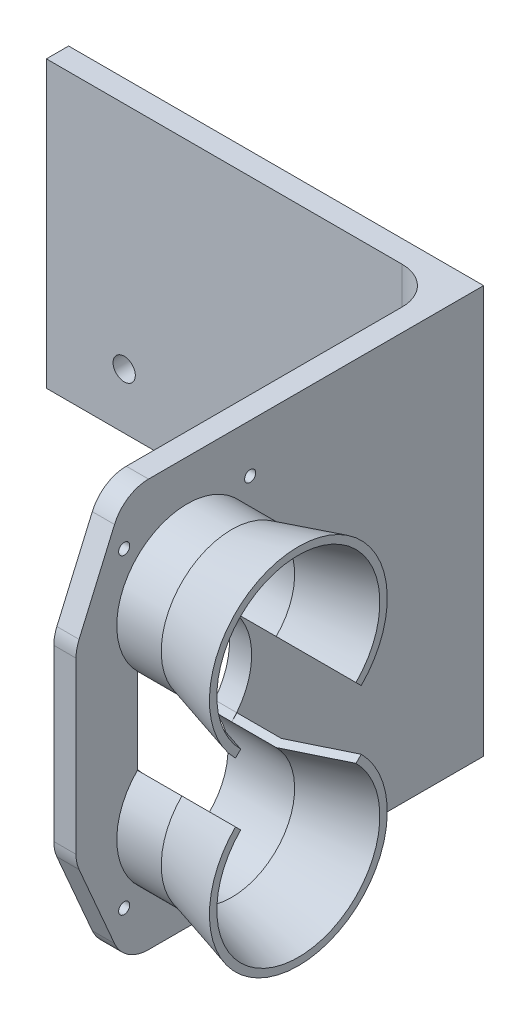
from build123d import *

# Parameters (mm, degrees)
EXTRUDE_1_DEPTH       = 27.5
SKETCH_3_R            = 0.75
CUT_EXTRUDE_3_DEPTH   = 3
REVOLVE_1_ANGLE       = 135
MIRROR_3_COPY_1_ANGLE = 135
MIRROR_3_COPY_2_ANGLE = 135
SKETCH_2_R            = 1.5
SKETCH_2_W            = 20
SKETCH_2_H            = 16.5
CUT_EXTRUDE_4_DEPTH   = 3
FILLET_1_R            = 5
FILLET_2_R            = 5


with BuildPart() as part:
    # 草图1 → 凸台-拉伸1 (new, symmetric)
    with BuildSketch(Plane(origin=(0, 0, 0), x_dir=(1, 0, 0), z_dir=(0, 1, 0))):
        Polygon((-30.117647059, 27.284313725), (25.882352941, 27.284313725), (25.882352941, -27.715686275), (22.882352941, -27.715686275), (22.882352941, 24.284313725), (-30.117647059, 24.284313725), align=None)
    extrude(amount=EXTRUDE_1_DEPTH, both=True)

    # 草图3 → 切除-拉伸3 (cut)
    with BuildSketch(Plane(origin=(25.882352941, 0, 0), x_dir=(0, 0, -1), z_dir=(1, 0, 0))):
        with BuildLine():
            Line((-12.715686275, 12.5), (-6.705278634, 6.48959236))
            ThreePointArc((-6.705278634, 6.48959236), (-4.862710248, 9.247190825), (-4.215686275, 12.5))
            ThreePointArc((-4.215686275, 12.5), (-6.705278634, 18.51040764), (-12.715686275, 21))
            Line((-12.715686275, 21), (-12.715686275, 12.5))
        make_face()
        with BuildLine():
            ThreePointArc((-12.715686275, 4), (-9.462877099, 4.647023974), (-6.705278634, 6.48959236))
            Line((-6.705278634, 6.48959236), (-12.715686275, 12.5))
            Line((-12.715686275, 12.5), (-12.715686275, 4))
        make_face()
        with BuildLine():
            Line((-12.715686275, 12.5), (-18.726093915, 6.48959236))
            ThreePointArc((-18.726093915, 6.48959236), (-15.96849545, 4.647023974), (-12.715686275, 4))
            Line((-12.715686275, 4), (-12.715686275, 12.5))
        make_face()
        with BuildLine():
            ThreePointArc((-12.715686275, 21), (-20.568662301, 15.752809175), (-18.726093915, 6.48959236))
            Line((-18.726093915, 6.48959236), (-12.715686275, 12.5))
            Line((-12.715686275, 12.5), (-12.715686275, 21))
        make_face()
        with BuildLine():
            Line((-12.715686275, 3), (-12.715686275, 0))
            Line((-12.715686275, 0), (-4.017201465, 0))
            ThreePointArc((-4.017201465, 0), (-4.536839235, 3.044356098), (-6.036908978, 5.743970558))
            ThreePointArc((-6.036908978, 5.743970558), (-9.105442495, 3.712728532), (-12.715686275, 3))
        make_face()
        with BuildLine():
            Line((-4.017201465, 0), (-12.715686275, 0))
            Line((-12.715686275, 0), (-12.715686275, -3))
            ThreePointArc((-12.715686275, -3), (-9.105442495, -3.712728532), (-6.036908978, -5.743970558))
            ThreePointArc((-6.036908978, -5.743970558), (-4.536839235, -3.044356098), (-4.017201465, 0))
        make_face()
        with BuildLine():
            Line((-19.394463571, 5.743970558), (-19.394463571, 0))
            Line((-19.394463571, 0), (-12.715686275, 0))
            Line((-12.715686275, 0), (-12.715686275, 3))
            ThreePointArc((-12.715686275, 3), (-16.325930054, 3.712728532), (-19.394463571, 5.743970558))
        make_face()
        with BuildLine():
            Line((-12.715686275, 0), (-19.394463571, 0))
            Line((-19.394463571, 0), (-19.394463571, -5.743970558))
            ThreePointArc((-19.394463571, -5.743970558), (-16.325930054, -3.712728532), (-12.715686275, -3))
            Line((-12.715686275, -3), (-12.715686275, 0))
        make_face()
        with BuildLine():
            Line((-6.705278634, -6.48959236), (-12.715686275, -12.5))
            Line((-12.715686275, -12.5), (-12.715686275, -21))
            ThreePointArc((-12.715686275, -21), (-6.705278634, -18.51040764), (-4.215686275, -12.5))
            ThreePointArc((-4.215686275, -12.5), (-4.862710248, -9.247190825), (-6.705278634, -6.48959236))
        make_face()
        with BuildLine():
            Line((-12.715686275, -4), (-12.715686275, -12.5))
            Line((-12.715686275, -12.5), (-6.705278634, -6.48959236))
            ThreePointArc((-6.705278634, -6.48959236), (-9.462877099, -4.647023974), (-12.715686275, -4))
        make_face()
        with BuildLine():
            ThreePointArc((-12.715686275, -4), (-15.96849545, -4.647023974), (-18.726093915, -6.48959236))
            Line((-18.726093915, -6.48959236), (-12.715686275, -12.5))
            Line((-12.715686275, -12.5), (-12.715686275, -4))
        make_face()
        with BuildLine():
            Line((-12.715686275, -12.5), (-18.726093915, -6.48959236))
            ThreePointArc((-18.726093915, -6.48959236), (-20.568662301, -15.752809175), (-12.715686275, -21))
            Line((-12.715686275, -21), (-12.715686275, -12.5))
        make_face()
        with Locations((-21.215686275, -21)):
            Circle(SKETCH_3_R)
        with Locations((-4.215686275, -21)):
            Circle(SKETCH_3_R)
        with Locations((-21.215686275, 21)):
            Circle(SKETCH_3_R)
        with Locations((-4.215686275, 21)):
            Circle(SKETCH_3_R)
        with BuildLine():
            ThreePointArc((-12.715686275, -3), (-16.325930054, -3.712728532), (-19.394463571, -5.743970558))
            Line((-19.394463571, -5.743970558), (-18.726093915, -6.48959236))
            ThreePointArc((-18.726093915, -6.48959236), (-15.96849545, -4.647023974), (-12.715686275, -4))
            ThreePointArc((-12.715686275, -4), (-9.462877099, -4.647023974), (-6.705278634, -6.48959236))
            Line((-6.705278634, -6.48959236), (-6.036908978, -5.743970558))
            ThreePointArc((-6.036908978, -5.743970558), (-9.105442495, -3.712728532), (-12.715686275, -3))
        make_face()
        with BuildLine():
            Line((-18.726093915, 6.48959236), (-19.394463571, 5.743970558))
            ThreePointArc((-19.394463571, 5.743970558), (-16.325930054, 3.712728532), (-12.715686275, 3))
            ThreePointArc((-12.715686275, 3), (-9.105442495, 3.712728532), (-6.036908978, 5.743970558))
            Line((-6.036908978, 5.743970558), (-6.705278634, 6.48959236))
            ThreePointArc((-6.705278634, 6.48959236), (-9.462877099, 4.647023974), (-12.715686275, 4))
            ThreePointArc((-12.715686275, 4), (-15.96849545, 4.647023974), (-18.726093915, 6.48959236))
        make_face()
        Polygon((-21.215686275, 27.5), (-23.783279652, 27.5), (-27.715686275, 27.5), (-27.715686275, 23.567593377), (-27.715686275, 20.249825378), (-27.715686275, 12.5), align=None)
        Polygon((-21.215686275, -27.5), (-27.715686275, -12.5), (-27.715686275, -20.249825378), (-27.715686275, -23.567593377), (-27.715686275, -27.5), (-23.783279652, -27.5), align=None)
    extrude(amount=-CUT_EXTRUDE_3_DEPTH, mode=Mode.SUBTRACT)

    # 草图5 → 旋转1 (revolve)
    with BuildSketch(Plane(origin=(0, 0, 12.715686275), x_dir=(0, -1, 0), z_dir=(0, 0, 1))):
        Polygon((-22, 25.882352941), (-21, 25.882352941), (-21, 31.882352941), (-23.5, 40.882352941), (-24.5, 40.882352941), (-22, 31.882352941), align=None)
    revolve_1 = revolve(axis=Axis((32.882352941, 12.5, 12.715686275), (-1, 0, 0)), revolution_arc=REVOLVE_1_ANGLE)

    # 镜向1: 旋转1 across plane
    add(revolve_1.mirror(Plane.ZX))

    # 镜向2: 旋转1 across plane
    add(revolve_1.mirror(Plane.XY.offset(12.715686275)))

    # 镜向3 copy 1 sketch → 镜向3 copy 1 (revolve)
    with BuildSketch(Plane.YX.offset(-12.715686275)):
        Polygon((-22, 25.882352941), (-21, 25.882352941), (-21, 31.882352941), (-23.5, 40.882352941), (-24.5, 40.882352941), (-22, 31.882352941), align=None)
    revolve(axis=Axis((32.882352941, -12.5, 12.715686275), (-1, 0, 0)), revolution_arc=MIRROR_3_COPY_1_ANGLE)

    # 镜向3 copy 2 sketch → 镜向3 copy 2 (revolve)
    with BuildSketch(Plane(origin=(0, 0, 12.715686275), x_dir=(0, -1, 0), z_dir=(0, 0, -1))):
        Polygon((-22, -25.882352941), (-21, -25.882352941), (-21, -31.882352941), (-23.5, -40.882352941), (-24.5, -40.882352941), (-22, -31.882352941), align=None)
    revolve(axis=Axis((32.882352941, 12.5, 12.715686275), (1, 0, 0)), revolution_arc=MIRROR_3_COPY_2_ANGLE)

    # 草图2 → 切除-拉伸4 (cut)
    with BuildSketch(Plane(origin=(0, 0, -27.284313725), x_dir=(-1, 0, 0), z_dir=(0, 0, -1))):
        with Locations((-0.382352941, -3.5)):
            Circle(SKETCH_2_R)
        with Locations((20.117647059, -19.25)):
            Rectangle(SKETCH_2_W, SKETCH_2_H)
        with Locations((19.617647059, -3.5)):
            Circle(SKETCH_2_R)
    extrude(amount=-CUT_EXTRUDE_4_DEPTH, mode=Mode.SUBTRACT)

    # 圆角1
    fillet_1_edges = [part.edges().sort_by_distance(p)[0] for p in [
        (22.882352941, 0, -24.284313725),
    ]]
    fillet(fillet_1_edges, radius=FILLET_1_R)

    # 圆角2
    fillet_2_edges = [part.edges().sort_by_distance(p)[0] for p in [
        (24.382352941, 12.5, 27.715686275),
        (24.382352941, 27.5, 21.215686275),
        (24.382352941, -12.5, 27.715686275),
        (24.382352941, -27.5, 21.215686275),
    ]]
    fillet(fillet_2_edges, radius=FILLET_2_R)


solid = part.part
